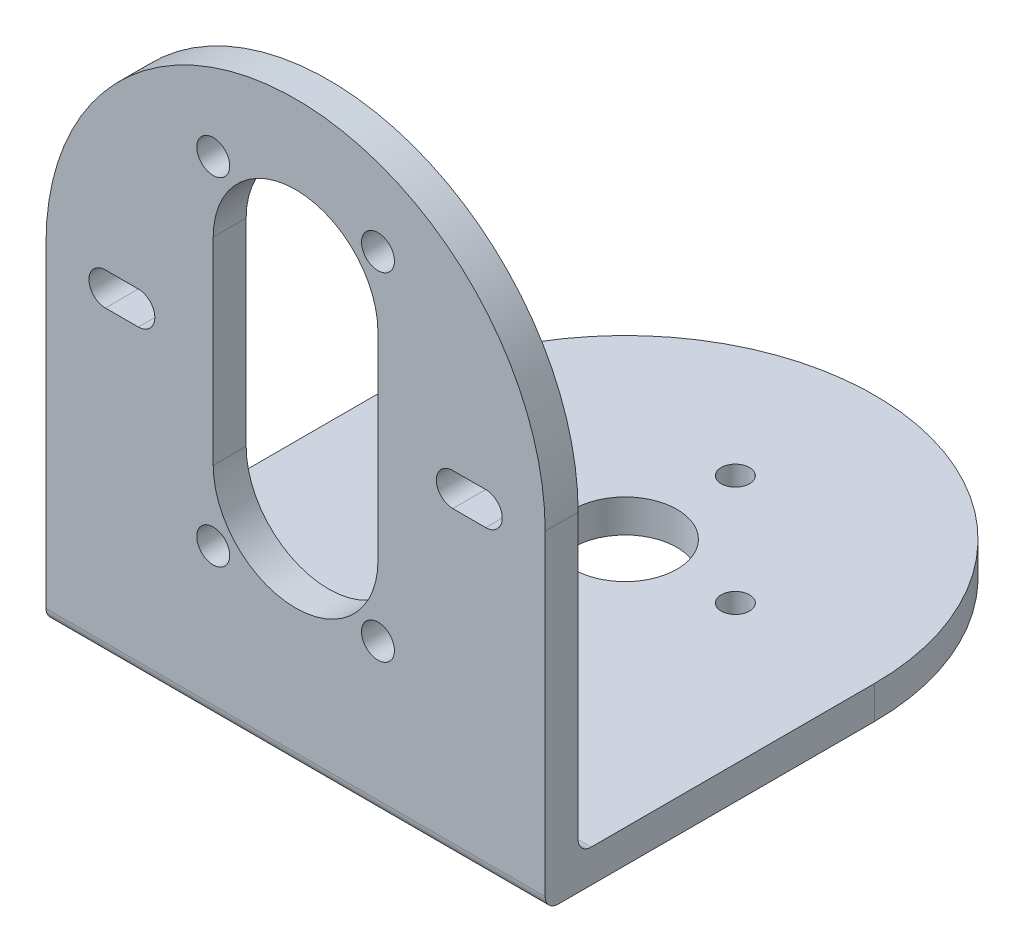
from build123d import *

# Parameters (mm, degrees)
SKETCH1_R           = 4
BOSS_EXTRUDE1_DEPTH = 2.54
SKETCH2_R           = 1.09
CUT_EXTRUDE1_DEPTH  = 5
CIRPATTERN1_COUNT   = 4
SKETCH3_R           = 1.27
BOSS_EXTRUDE2_DEPTH = 2.54
FILLET1_R           = 1


with BuildPart() as part:
    # Sketch1 → Boss-Extrude1 (new body)
    with BuildSketch(Plane(origin=(0, 0, 0), x_dir=(1, 0, 0), z_dir=(0, 1, 0))):
        with BuildLine():
            Line((-19.24, 0), (-19.24, -25.4))
            Line((-19.24, -25.4), (19.24, -25.4))
            Line((19.24, -25.4), (19.24, 0))
            ThreePointArc((19.24, 0), (0, 19.24), (-19.24, 0))
        make_face()
        with Locations(Location((0, 0, 0), (0, 0, 270))):
            Circle(SKETCH1_R, mode=Mode.SUBTRACT)
    extrude(amount=BOSS_EXTRUDE1_DEPTH)

    # Sketch2 → Cut-Extrude1 (cut, symmetric)
    with BuildSketch(Plane(origin=(0, 2.54, 0), x_dir=(1, 0, 0), z_dir=(0, 1, 0))):
        with Locations(Location((0, 8.5, 0), (0, 0, 270))):
            Circle(SKETCH2_R)
    cut_extrude1 = extrude(amount=CUT_EXTRUDE1_DEPTH, both=True, mode=Mode.SUBTRACT)

    # CirPattern1: Cut-Extrude1 ×4 about axis
    cirpattern1_axis = Axis((0, 0, 0), (0, 1, 0))
    for i in range(1, CIRPATTERN1_COUNT):
        add(cut_extrude1.rotate(cirpattern1_axis, i * 360 / CIRPATTERN1_COUNT), mode=Mode.SUBTRACT)

    # Sketch3 → Boss-Extrude2 (add)
    with BuildSketch(Plane.XY.offset(25.4)):
        with BuildLine():
            Line((19.24, 2.54), (19.24, 25.4))
            ThreePointArc((19.24, 25.4), (0, 44.64), (-19.24, 25.4))
            Line((-19.24, 25.4), (-19.24, 2.54))
            Line((-19.24, 2.54), (19.24, 2.54))
        make_face()
        with Locations((6.35, 37.62)):
            Circle(SKETCH3_R, mode=Mode.SUBTRACT)
        with Locations((6.35, 11.62)):
            Circle(SKETCH3_R, mode=Mode.SUBTRACT)
        with Locations(Location((-6.35, 11.62, 0), (0, 0, 180))):
            Circle(SKETCH3_R, mode=Mode.SUBTRACT)
        with Locations(Location((-6.35, 37.62, 0), (0, 0, 180))):
            Circle(SKETCH3_R, mode=Mode.SUBTRACT)
        with BuildLine():
            Line((6.35, 32.24), (6.35, 17))
            ThreePointArc((6.35, 17), (0, 10.65), (-6.35, 17))
            Line((-6.35, 17), (-6.35, 32.24))
            ThreePointArc((-6.35, 32.24), (0, 38.59), (6.35, 32.24))
        make_face(mode=Mode.SUBTRACT)
        with BuildLine():
            Line((14.66, 25.89), (12.12, 25.89))
            ThreePointArc((12.12, 25.89), (10.85, 24.62), (12.12, 23.35))
            Line((12.12, 23.35), (14.66, 23.35))
            ThreePointArc((14.66, 23.35), (15.93, 24.62), (14.66, 25.89))
        make_face(mode=Mode.SUBTRACT)
        with BuildLine():
            Line((-14.66, 23.35), (-12.12, 23.35))
            ThreePointArc((-12.12, 23.35), (-10.85, 24.62), (-12.12, 25.89))
            Line((-12.12, 25.89), (-14.66, 25.89))
            ThreePointArc((-14.66, 25.89), (-15.93, 24.62), (-14.66, 23.35))
        make_face(mode=Mode.SUBTRACT)
    extrude(amount=-BOSS_EXTRUDE2_DEPTH)

    # Fillet1
    fillet1_edges = [part.edges().sort_by_distance(p)[0] for p in [
        (0, 0, 25.4),
        (0, 2.54, 22.86),
    ]]
    fillet(fillet1_edges, radius=FILLET1_R)


solid = part.part
